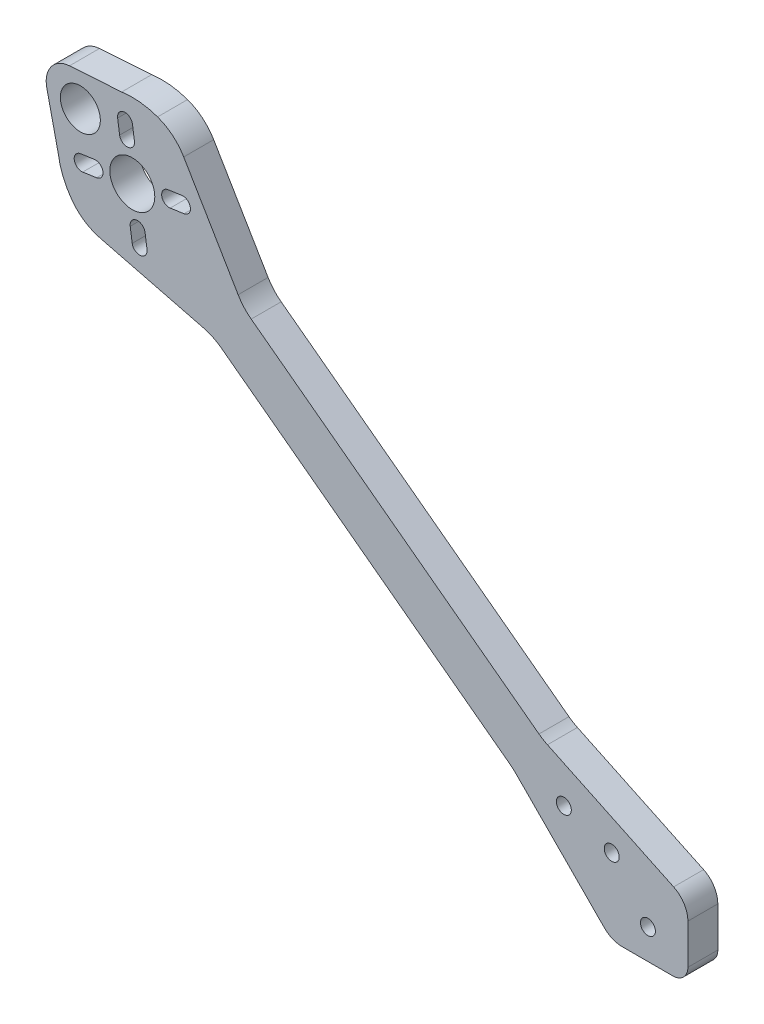
from build123d import *

# Parameters (mm, degrees)
CROQUIS1_R              = 1.5
CROQUIS1_R_2            = 4
CROQUIS1_R_3            = 4.5
SALIENTE_EXTRUIR1_DEPTH = 6


with BuildPart() as part:
    # Croquis1 → Saliente-Extruir1 (new body)
    with BuildSketch(Plane.XY):
        with BuildLine():
            Line((0, 3), (0, 11.005922656))
            ThreePointArc((0, 11.005922656), (-0.772770469, 13.676227974), (-2.852212196, 15.521120055))
            Line((-2.852212196, 15.521120055), (-28.127681877, 27.544148224))
            ThreePointArc((-28.127681877, 27.544148224), (-29.001474549, 28.014307534), (-29.824371512, 28.568747792))
            Line((-29.824371512, 28.568747792), (-87.188450944, 71.505241853))
            Line((-87.188450944, 71.505241853), (-87.469353477, 71.715494855))
            ThreePointArc((-87.469353477, 71.715494855), (-88.923053354, 73.046141889), (-90.087562008, 74.636042659))
            Line((-90.087562008, 74.636042659), (-100.983022225, 93.084520497))
            ThreePointArc((-100.983022225, 93.084520497), (-103.222374148, 95.706983908), (-106.219380606, 97.412845469))
            ThreePointArc((-106.219380606, 97.412845469), (-109.77333448, 98.216571105), (-113.416224758, 98.139672096))
            Line((-113.416224758, 98.139672096), (-123.864042756, 97.456117574))
            ThreePointArc((-123.864042756, 97.456117574), (-127.540510381, 95.462917227), (-128.416669029, 91.373710966))
            Line((-128.416669029, 91.373710966), (-126.127738921, 81.156815809))
            ThreePointArc((-126.127738921, 81.156815809), (-125.174752843, 77.639944959), (-123.401912494, 74.45661335))
            ThreePointArc((-123.401912494, 74.45661335), (-120.920490039, 72.061920473), (-117.773176379, 70.652513469))
            Line((-117.773176379, 70.652513469), (-97.001714211, 65.398586624))
            ThreePointArc((-97.001714211, 65.398586624), (-95.148050081, 64.729412392), (-93.461618719, 63.709699625))
            Line((-93.461618719, 63.709699625), (-35.612091664, 20.409852413))
            ThreePointArc((-35.612091664, 20.409852413), (-35.03729077, 19.945518736), (-34.498346176, 19.44000854))
            Line((-34.498346176, 19.44000854), (-16.717412791, 1.482024321))
            ThreePointArc((-16.717412791, 1.482024321), (-15.089260875, 0.385356005), (-13.164407425, 0))
            Line((-13.164407425, 0), (-3, 0))
            ThreePointArc((-3, 0), (-0.878679656, 0.878679656), (0, 3))
        make_face()
        with Locations((-24.85, 18.6)):
            Circle(CROQUIS1_R, mode=Mode.SUBTRACT)
        with Locations((-8, 6)):
            Circle(CROQUIS1_R, mode=Mode.SUBTRACT)
        with Locations((-121.688087495, 91.082431686)):
            Circle(CROQUIS1_R_2, mode=Mode.SUBTRACT)
        with Locations((-111.280553696, 83.292486871)):
            Circle(CROQUIS1_R_3, mode=Mode.SUBTRACT)
        with Locations((-15.25, 15.25)):
            Circle(CROQUIS1_R, mode=Mode.SUBTRACT)
        with BuildLine():
            Line((-111.255210399, 93.651630548), (-110.856551801, 90.880155972))
            ThreePointArc((-110.856551801, 90.880155972), (-112.127703217, 89.181870344), (-113.825988846, 90.45302176))
            Line((-113.825988846, 90.45302176), (-114.224647444, 93.224496335))
            ThreePointArc((-114.224647444, 93.224496335), (-112.953496028, 94.922781964), (-111.255210399, 93.651630548))
        make_face(mode=Mode.SUBTRACT)
        with BuildLine():
            Line((-100.921410019, 83.267143574), (-103.692884594, 82.868484976))
            ThreePointArc((-103.692884594, 82.868484976), (-105.391170223, 84.139636392), (-104.120018807, 85.837922021))
            Line((-104.120018807, 85.837922021), (-101.348544231, 86.236580619))
            ThreePointArc((-101.348544231, 86.236580619), (-99.650258603, 84.965429203), (-100.921410019, 83.267143574))
        make_face(mode=Mode.SUBTRACT)
        with BuildLine():
            Line((-111.305896992, 72.933343194), (-111.704555591, 75.704817769))
            ThreePointArc((-111.704555591, 75.704817769), (-110.433404174, 77.403103398), (-108.735118546, 76.131951982))
            Line((-108.735118546, 76.131951982), (-108.336459947, 73.360477407))
            ThreePointArc((-108.336459947, 73.360477407), (-109.607611364, 71.662191778), (-111.305896992, 72.933343194))
        make_face(mode=Mode.SUBTRACT)
        with BuildLine():
            Line((-121.639697373, 83.317830168), (-118.868222797, 83.716488766))
            ThreePointArc((-118.868222797, 83.716488766), (-117.169937169, 82.44533735), (-118.441088585, 80.747051721))
            Line((-118.441088585, 80.747051721), (-121.21256316, 80.348393122))
            ThreePointArc((-121.21256316, 80.348393122), (-122.910848789, 81.619544539), (-121.639697373, 83.317830168))
        make_face(mode=Mode.SUBTRACT)
    extrude(amount=SALIENTE_EXTRUIR1_DEPTH)


solid = part.part
